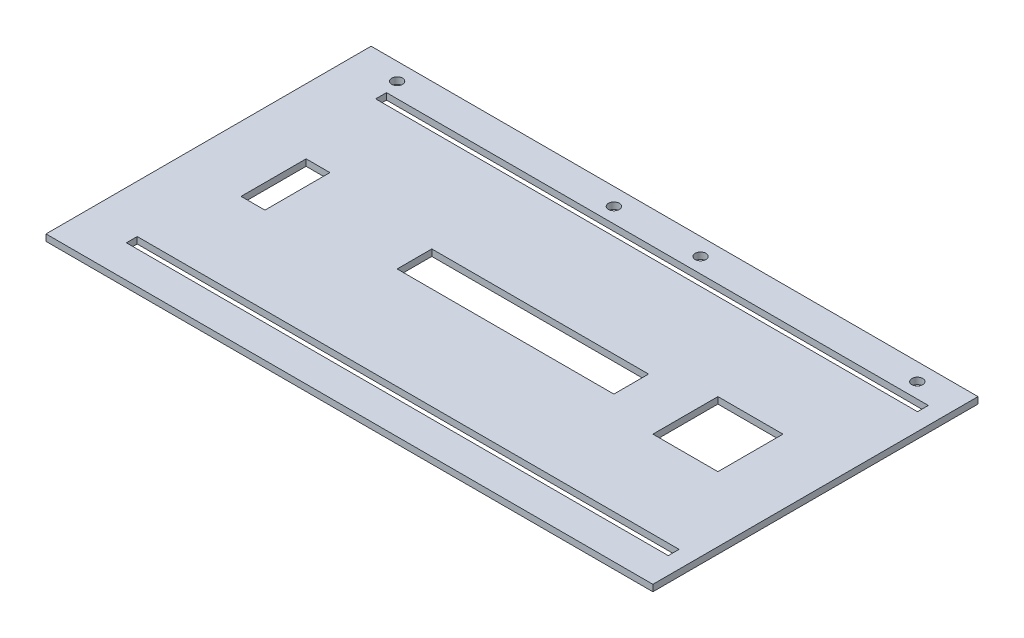
from build123d import *

# Parameters (mm, degrees)
SKETCH_1_W          = 280
SKETCH_1_H          = 150
EXTRUDE_1_DEPTH     = 3
SKETCH_2_W          = 100
SKETCH_2_H          = 16
CUT_EXTRUDE_1_DEPTH = 3
SKETCH_3_W          = 250
SKETCH_3_H          = 5
CUT_EXTRUDE_2_DEPTH = 3
SKETCH_4_R          = 2.5
CUT_EXTRUDE_3_DEPTH = 3
SKETCH_5_W          = 30
SKETCH_5_H          = 30
SKETCH_5_W_2        = 11
CUT_EXTRUDE_4_DEPTH = 3


with BuildPart() as part:
    # 草图1 → 凸台-拉伸1 (new body)
    with BuildSketch(Plane(origin=(0, 0, 0), x_dir=(1, 0, 0), z_dir=(0, 1, 0))):
        with Locations((69.822750754, -35.664148933)):
            Rectangle(SKETCH_1_W, SKETCH_1_H)
    extrude(amount=EXTRUDE_1_DEPTH)

    # 草图2 → 切除-拉伸1 (cut)
    with BuildSketch(Plane(origin=(0, 3, 0), x_dir=(1, 0, 0), z_dir=(0, 1, 0))):
        with Locations((74.822750754, -35.664148933)):
            Rectangle(SKETCH_2_W, SKETCH_2_H)
    extrude(amount=-CUT_EXTRUDE_1_DEPTH, mode=Mode.SUBTRACT)

    # 草图3 → 切除-拉伸2 (cut)
    with BuildSketch(Plane.XZ):
        with Locations((76.910352346, 93.164148933)):
            Rectangle(SKETCH_3_W, SKETCH_3_H)
        with Locations((76.910352346, -21.835851067)):
            Rectangle(SKETCH_3_W, SKETCH_3_H)
    extrude(amount=-CUT_EXTRUDE_2_DEPTH, mode=Mode.SUBTRACT)

    # 草图4 → 切除-拉伸3 (cut)
    with BuildSketch(Plane(origin=(0, 3, 0), x_dir=(1, 0, 0), z_dir=(0, 1, 0))):
        with Locations(Location((-50.177249246, 31.335851067, 0), (0, 0, 270))):
            Circle(SKETCH_4_R)
        with Locations(Location((49.822750754, 31.335851067, 0), (0, 0, 270))):
            Circle(SKETCH_4_R)
        with Locations(Location((189.822750754, 31.335851067, 0), (0, 0, 270))):
            Circle(SKETCH_4_R)
        with Locations(Location((89.822750754, 31.335851067, 0), (0, 0, 270))):
            Circle(SKETCH_4_R)
    extrude(amount=-CUT_EXTRUDE_3_DEPTH, mode=Mode.SUBTRACT)

    # 草图5 → 切除-拉伸4 (cut)
    with BuildSketch(Plane.XZ):
        with Locations((164.822750754, 35.664148933)):
            Rectangle(SKETCH_5_W, SKETCH_5_H)
        with Locations((-34.677249246, 35.664148933)):
            Rectangle(SKETCH_5_W_2, SKETCH_5_H)
    extrude(amount=-CUT_EXTRUDE_4_DEPTH, mode=Mode.SUBTRACT)


solid = part.part
